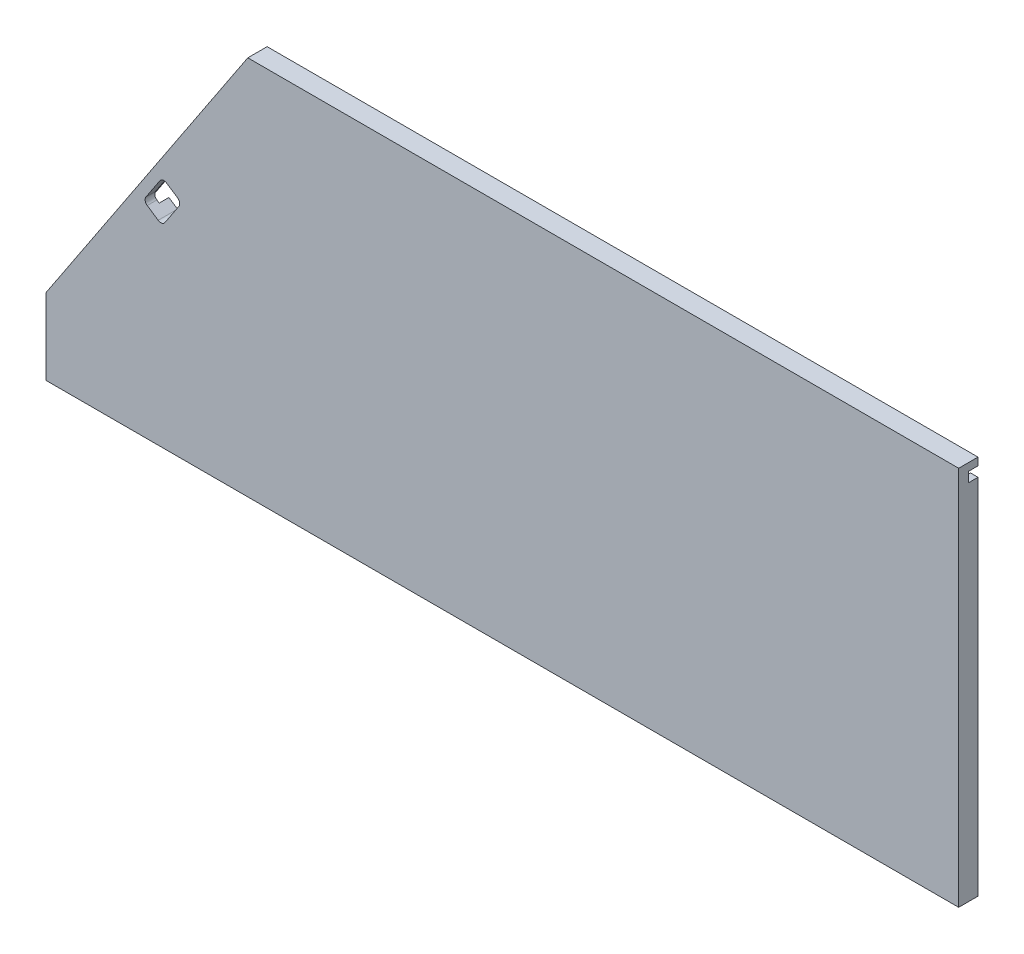
from build123d import *

# Parameters (mm, degrees)
BOSS_EXTRUDE1_DEPTH = 12.7
CUT_EXTRUDE2_DEPTH  = 6.35
CUT_EXTRUDE3_DEPTH  = 571.619829491
FILLET1_R           = 3.175
SKETCH7_W           = 110.518116872
SKETCH7_H           = 6.5
CUT_EXTRUDE4_DEPTH  = 6.35


with BuildPart() as part:
    # Sketch1 → Boss-Extrude1 (new body)
    with BuildSketch(Plane.XY):
        Polygon((-524.529885057, -25.691954023), (75.470114943, -25.691954023), (75.470114943, 224.308045977), (-391.864893443, 224.308045977), (-524.529885057, 24.308045977), align=None)
    extrude(amount=BOSS_EXTRUDE1_DEPTH)

    # Sketch4 → Cut-Extrude2 (cut)
    with BuildSketch(Plane.XY):
        Polygon((-519.529885057, 22.800489254), (-519.529885057, -20.691954023), (70.470114943, -20.691954023), (70.470114943, 219.308045977), (-389.181518234, 219.308045977), align=None)
        Polygon((-513.029885057, 20.840665514), (-513.029885057, -14.191954023), (63.970114943, -14.191954023), (63.970114943, 212.808045977), (-385.693130461, 212.808045977), align=None, mode=Mode.SUBTRACT)
    extrude(amount=CUT_EXTRUDE2_DEPTH, mode=Mode.SUBTRACT)

    # Sketch6 → Cut-Extrude3 (cut, through all)
    with BuildSketch(Plane(origin=(0, 0, 0), x_dir=(-1, 0, 0), z_dir=(0, 0, -1))):
        Polygon((443.734064292, 125.308045977), (435.400730959, 119.780337993), (448.114459322, 100.613671326), (456.447792655, 106.14137931), (460.614459322, 108.905233302), (447.900730959, 128.071899969), align=None)
    extrude(amount=-CUT_EXTRUDE3_DEPTH, mode=Mode.SUBTRACT)

    # Fillet1
    fillet1_edges = [part.edges().sort_by_distance(p)[0] for p in [
        (-447.900730959, 128.071899969, 9.525),
        (-460.614459322, 108.905233302, 9.525),
        (-435.400730959, 119.780337993, 6.35),
        (-448.114459322, 100.613671326, 6.35),
    ]]
    fillet(fillet1_edges, radius=FILLET1_R)

    # Sketch7 → Cut-Extrude4 (cut)
    with BuildSketch(Plane(origin=(0, 0, 0), x_dir=(-1, 0, 0), z_dir=(0, 0, -1))):
        with Locations((-36.124416508, 216.058045977)):
            Rectangle(SKETCH7_W, SKETCH7_H)
    extrude(amount=-CUT_EXTRUDE4_DEPTH, mode=Mode.SUBTRACT)


solid = part.part
